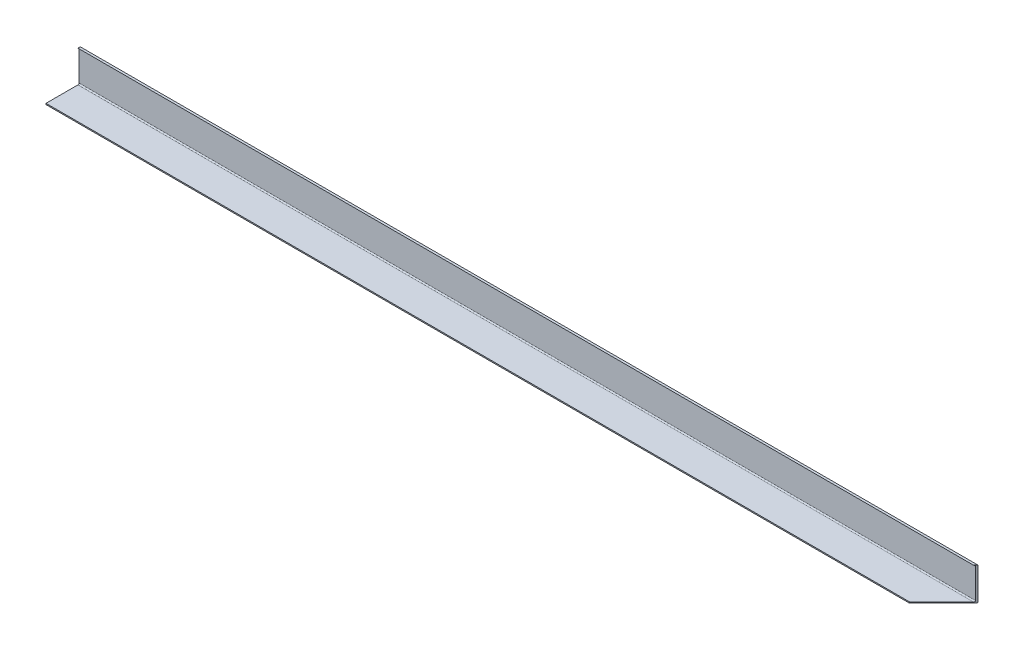
from build123d import *

# Parameters (mm, degrees)
BOSS_EXTRUDE1_DEPTH     = 2310
FILLET1_R               = 3
CUT_EXTRUDE1_DEPTH      = 85
CUT_EXTRUDE1_DEPTH_BACK = 2315.387175906
SKETCH6_W               = 2310
SKETCH6_H               = 30
CUT_EXTRUDE2_DEPTH      = 41


with BuildPart() as part:
    # Sketch1 → Boss-Extrude1 (new body)
    with BuildSketch(Plane(origin=(0, 0, 0), x_dir=(0, 0, -1), z_dir=(1, 0, 0))):
        Polygon((0, 0), (85, 0), (85, 82), (47, 82), (47, 112), (50, 112), (50, 85), (88, 85), (88, -3), (0, -3), align=None)
    extrude(amount=BOSS_EXTRUDE1_DEPTH)

    # Fillet1
    fillet1_edges = [part.edges().sort_by_distance(p)[0] for p in [
        (1155, 0, -85),
        (1155, 82, -85),
        (1155, 82, -47),
        (1155, 85, -50),
        (1155, 85, -88),
        (1155, -3, -88),
    ]]
    fillet(fillet1_edges, radius=FILLET1_R)

    # Sketch3 → Cut-Extrude1 (cut, two sides: drawn at the far end of the back side and taken through both)
    with BuildSketch(Plane(origin=(0, 0, 0), x_dir=(1, 0, 0), z_dir=(0, 1, 0)).offset(-CUT_EXTRUDE1_DEPTH_BACK)):
        Polygon((2310, 88), (2222, 0), (2310, 0), align=None)
    extrude(amount=CUT_EXTRUDE1_DEPTH + CUT_EXTRUDE1_DEPTH_BACK, mode=Mode.SUBTRACT)

    # Sketch6 → Cut-Extrude2 (cut)
    with BuildSketch(Plane.XY.offset(-47)):
        with Locations((1155, 97)):
            Rectangle(SKETCH6_W, SKETCH6_H)
    extrude(amount=-CUT_EXTRUDE2_DEPTH, mode=Mode.SUBTRACT)


solid = part.part
